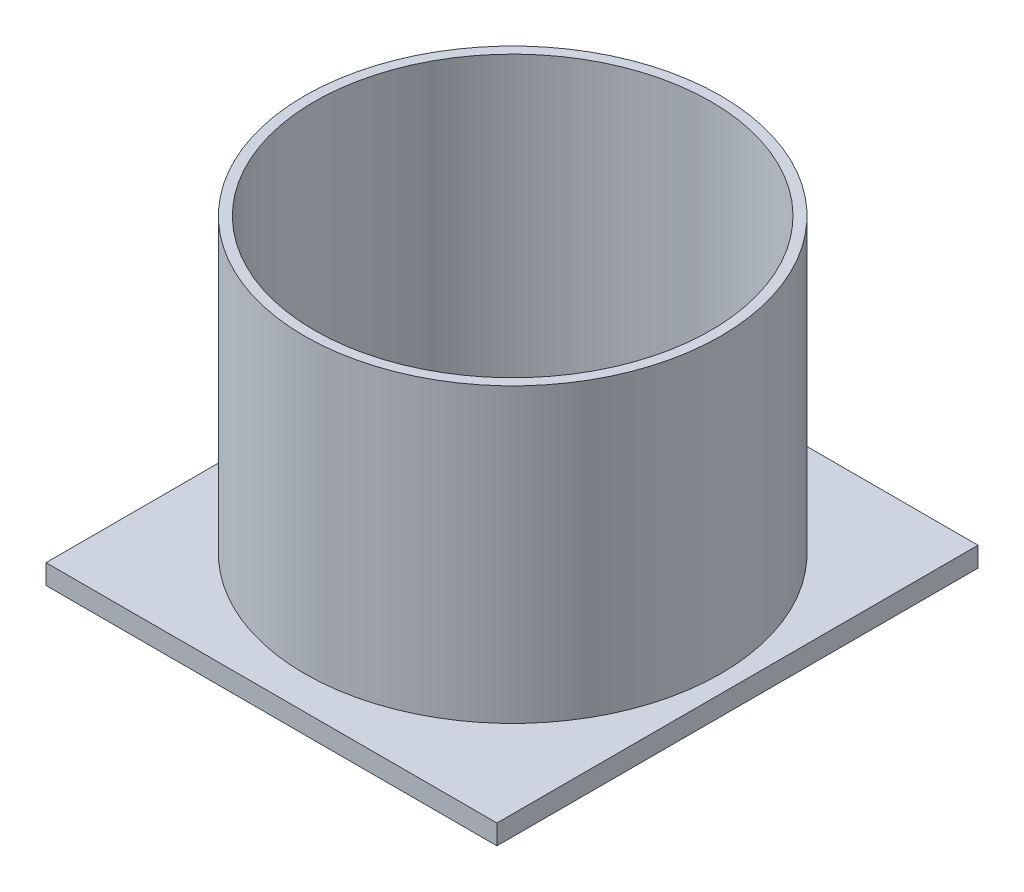
from build123d import *

# Parameters (mm, degrees)
CROQUIS1_W              = 41.5
CROQUIS1_H              = 44.4
SALIENTE_EXTRUIR1_DEPTH = 1.5
CROQUIS2_W              = 45.5
CROQUIS2_H              = 48.539759036
SALIENTE_EXTRUIR2_DEPTH = 2
CROQUIS3_R              = 21
SALIENTE_EXTRUIR3_DEPTH = 33
CROQUIS4_R              = 20
CORTAR_EXTRUIR1_DEPTH   = 72.653401873


with BuildPart() as part:
    # Croquis1 → Saliente-Extruir1 (new body)
    with BuildSketch(Plane(origin=(0, 0, 0), x_dir=(1, 0, 0), z_dir=(0, 1, 0))):
        with Locations((20.75, 22.2)):
            Rectangle(CROQUIS1_W, CROQUIS1_H)
    extrude(amount=SALIENTE_EXTRUIR1_DEPTH)

    # Croquis2 → Saliente-Extruir2 (add)
    with BuildSketch(Plane(origin=(0, 1.5, 0), x_dir=(1, 0, 0), z_dir=(0, 1, 0))):
        with Locations((20.75, 22.130120482)):
            Rectangle(CROQUIS2_W, CROQUIS2_H)
    extrude(amount=SALIENTE_EXTRUIR2_DEPTH)

    # Croquis3 → Saliente-Extruir3 (add)
    with BuildSketch(Plane.XZ):
        with Locations(Location((20.75, -22.2, 0), (0, 0, 270))):
            Circle(CROQUIS3_R)
    extrude(amount=-SALIENTE_EXTRUIR3_DEPTH)

    # Croquis4 → Cortar-Extruir1 (cut, through all)
    with BuildSketch(Plane(origin=(0, 33, 0), x_dir=(1, 0, 0), z_dir=(0, 1, 0))):
        with Locations(Location((20.75, 22.2, 0), (0, 0, 270))):
            Circle(CROQUIS4_R)
    extrude(amount=-CORTAR_EXTRUIR1_DEPTH, mode=Mode.SUBTRACT)


solid = part.part
